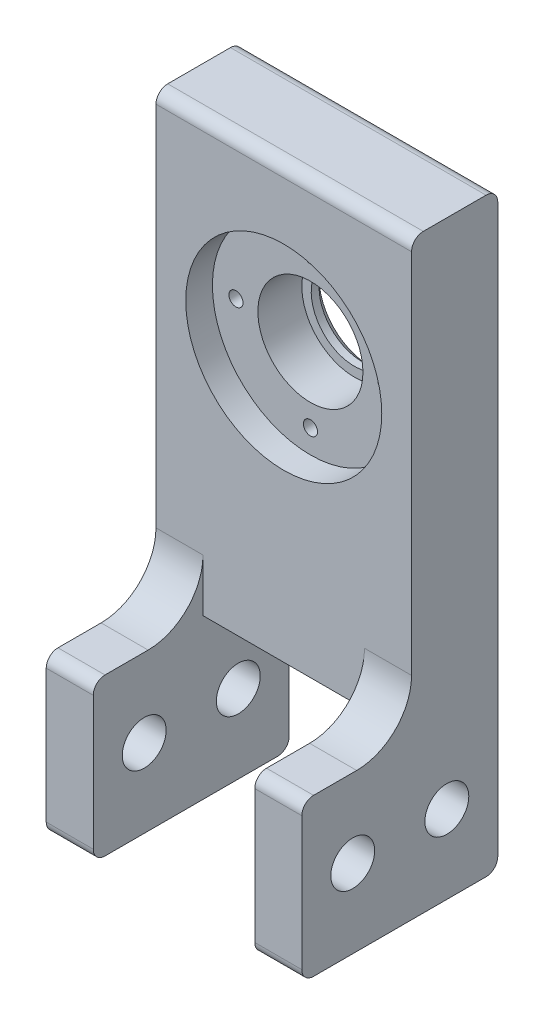
from build123d import *

# Parameters (mm, degrees)
EXTRUDE1_DEPTH      = 10.3
EXTRUDE1_DEPTH_BACK = 10.3
SKETCH1_W           = 11
SKETCH1_H           = 55
EXTRUDE2_DEPTH      = 6
SKETCH5_R           = 5.5
EXTRUDE4_DEPTH      = 69.744308855
SKETCH_1_R          = 2.8
CUT_EXTRUDE_1_DEPTH = 76.545350618
FILLET2_R           = 1.5
SKETCH_4_R          = 6.7
CUT_EXTRUDE_2_DEPTH = 9
SKETCH_5_R          = 12.5
CUT_EXTRUDE_3_DEPTH = 3.4
SKETCH_6_R          = 0.9
CUT_EXTRUDE_4_DEPTH = 7
CHAMFER_1_SIZE      = 1


with BuildPart() as part:
    # Sketch1 → Extrude1 (new, two sides: drawn at the far end of the back side and taken through both)
    with BuildSketch(Plane(origin=(0, 0, 0), x_dir=(0, 0, -1), z_dir=(1, 0, 0)).offset(-EXTRUDE1_DEPTH_BACK)):
        with Locations((0, 37.8)):
            Rectangle(SKETCH1_W, SKETCH1_H)
    extrude(amount=EXTRUDE1_DEPTH + EXTRUDE1_DEPTH_BACK)

    # Sketch2 → Extrude2 (add)
    with BuildSketch(Plane(origin=(10.3, 0, 0), x_dir=(0, 0, -1), z_dir=(1, 0, 0))):
        with BuildLine():
            Line((-19.5, 10), (-19.5, -10))
            Line((-19.5, -10), (5.5, -10))
            Line((5.5, -10), (5.5, 17))
            Line((5.5, 17), (5.5, 65.3))
            Line((5.5, 65.3), (-5.5, 65.3))
            Line((-5.5, 65.3), (-5.5, 17))
            ThreePointArc((-5.5, 17), (-7.550252532, 12.050252532), (-12.5, 10))
            Line((-12.5, 10), (-19.5, 10))
        make_face()
    extrude2 = extrude(amount=EXTRUDE2_DEPTH)

    # Mirror2: Extrude2 across plane
    add(extrude2.mirror(Plane(origin=(0, 0, 0), x_dir=(0, 0, 1), z_dir=(1, 0, 0))))

    # Sketch5 → Extrude4 (cut, through all)
    with BuildSketch(Plane.XY.offset(5.5)):
        with Locations((0, 44)):
            Circle(SKETCH5_R)
    extrude(amount=-EXTRUDE4_DEPTH, mode=Mode.SUBTRACT)

    # Эскиз1 → Вырез-Вытянуть1 (cut, through all)
    with BuildSketch(Plane(origin=(16.3, 0, 0), x_dir=(0, 0, -1), z_dir=(1, 0, 0))):
        with Locations((-13, 0)):
            Circle(SKETCH_1_R)
        with Locations(Location((-1, 0, 0), (0, 0, 180))):
            Circle(SKETCH_1_R)
    extrude(amount=-CUT_EXTRUDE_1_DEPTH, mode=Mode.SUBTRACT)

    # Fillet2
    fillet2_edges = [part.edges().sort_by_distance(p)[0] for p in [
        (13.3, -10, 19.5),
        (13.3, -10, -5.5),
        (13.3, 10, 19.5),
        (-13.3, -10, -5.5),
        (-13.3, -10, 19.5),
        (-13.3, 10, 19.5),
        (0, 65.3, 5.5),
        (0, 65.3, -5.5),
    ]]
    fillet(fillet2_edges, radius=FILLET2_R)

    # Эскиз4 → Вырез-Вытянуть2 (cut)
    with BuildSketch(Plane.XY.offset(5.5)):
        with Locations((0, 44)):
            Circle(SKETCH_4_R)
    extrude(amount=-CUT_EXTRUDE_2_DEPTH, mode=Mode.SUBTRACT)

    # Эскиз5 → Вырез-Вытянуть3 (cut)
    with BuildSketch(Plane.XY.offset(5.5)):
        with Locations((0, 44)):
            Circle(SKETCH_5_R)
    extrude(amount=-CUT_EXTRUDE_3_DEPTH, mode=Mode.SUBTRACT)

    # Эскиз6 → Вырез-Вытянуть4 (cut)
    with BuildSketch(Plane.XY.offset(2.1)):
        with Locations((0, 53.5)):
            Circle(SKETCH_6_R)
        with Locations((9.5, 44)):
            Circle(SKETCH_6_R)
        with Locations((0, 34.5)):
            Circle(SKETCH_6_R)
        with Locations((-9.5, 44)):
            Circle(SKETCH_6_R)
    extrude(amount=-CUT_EXTRUDE_4_DEPTH, mode=Mode.SUBTRACT)

    # Фаска1
    chamfer_1_edges = [part.edges().sort_by_distance(p)[0] for p in [
        (-5.5, 44, -5.5),
    ]]
    chamfer(chamfer_1_edges, length=CHAMFER_1_SIZE)


solid = part.part
